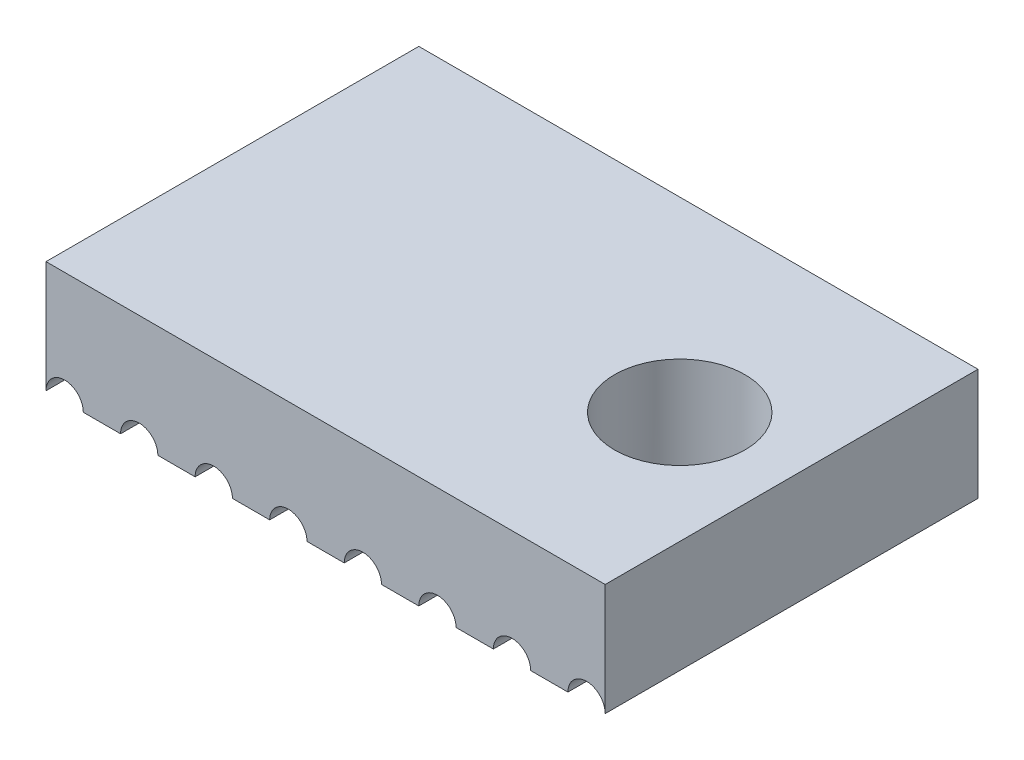
from build123d import *

# Parameters (mm, degrees)
SKETCH1_W           = 15
SKETCH1_H           = 10
BOSS_EXTRUDE1_DEPTH = 3
SKETCH2_R           = 1.75
CUT_EXTRUDE1_DEPTH  = 10.5
CUT_EXTRUDE2_DEPTH  = 13.854960132
LPATTERN1_COUNT     = 7
LPATTERN1_PITCH     = 2


with BuildPart() as part:
    # Sketch1 → Boss-Extrude1 (new body)
    with BuildSketch(Plane(origin=(0, 0, 0), x_dir=(1, 0, 0), z_dir=(0, 1, 0))):
        Rectangle(SKETCH1_W, SKETCH1_H)
    extrude(amount=BOSS_EXTRUDE1_DEPTH)

    # Sketch2 → Cut-Extrude1 (cut, through all)
    with BuildSketch(Plane(origin=(0, 3, 0), x_dir=(1, 0, 0), z_dir=(0, 1, 0))):
        with Locations(Location((4.5, 0, 0), (0, 0, 270))):
            Circle(SKETCH2_R)
    extrude(amount=-CUT_EXTRUDE1_DEPTH, mode=Mode.SUBTRACT)

    # Sketch3 → Cut-Extrude2 (cut, through all)
    with BuildSketch(Plane.XY.offset(5)):
        with BuildLine():
            Line((-7.5, 0), (-6.5, 0))
            ThreePointArc((-6.5, 0), (-7, 0.5), (-7.5, 0))
        make_face()
        with BuildLine():
            Line((-5.5, 0), (-4.5, 0))
            ThreePointArc((-4.5, 0), (-5, 0.5), (-5.5, 0))
        make_face()
    cut_extrude2 = extrude(amount=-CUT_EXTRUDE2_DEPTH, mode=Mode.SUBTRACT)

    # LPattern1: Cut-Extrude2 ×7
    with Locations(*[(i * LPATTERN1_PITCH, 0, 0) for i in range(1, LPATTERN1_COUNT)]):
        add(cut_extrude2, mode=Mode.SUBTRACT)


solid = part.part
